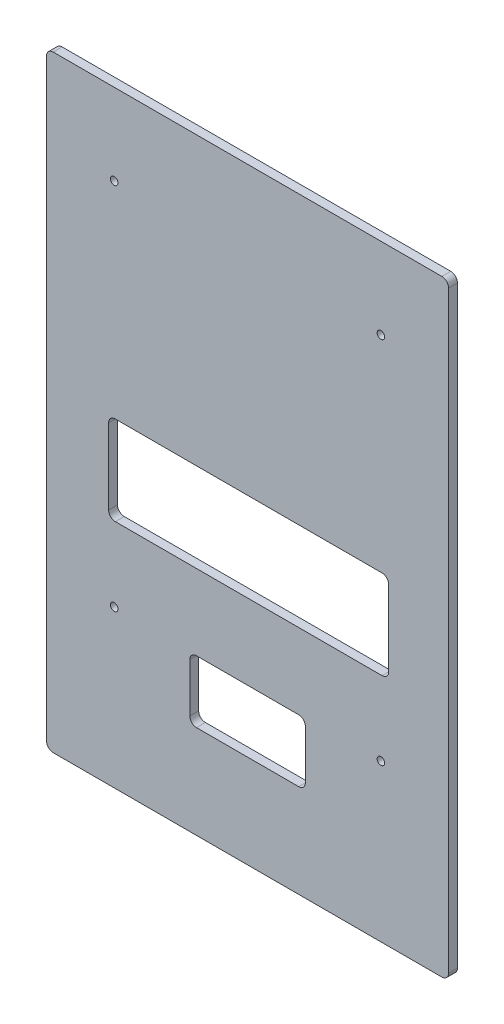
from build123d import *

# Parameters (mm, degrees)
ESQUISSE1_W        = 180.86
ESQUISSE1_H        = 273
ESQUISSE1_R        = 1.5
ESQUISSE1_W_2      = 52
ESQUISSE1_H_2      = 28
ESQUISSE1_W_3      = 126
ESQUISSE1_H_3      = 40
BOSS_EXTRU_1_DEPTH = 4
D_GAGEMENT_M31_D   = 3.4
CONG_1_R           = 3


with BuildPart() as part:
    # Esquisse1 → Boss.-Extru.1 (new body)
    with BuildSketch(Plane.XY):
        with Locations((90.43, 136.5)):
            Rectangle(ESQUISSE1_W, ESQUISSE1_H)
        with Locations((30.43, 236.5)):
            Circle(ESQUISSE1_R, mode=Mode.SUBTRACT)
        with Locations((150.43, 236.5)):
            Circle(ESQUISSE1_R, mode=Mode.SUBTRACT)
        with Locations((30.43, 70.5)):
            Circle(ESQUISSE1_R, mode=Mode.SUBTRACT)
        with Locations((150.43, 70.5)):
            Circle(ESQUISSE1_R, mode=Mode.SUBTRACT)
        with Locations((90.43, 56)):
            Rectangle(ESQUISSE1_W_2, ESQUISSE1_H_2, mode=Mode.SUBTRACT)
        with Locations((90.93, 124)):
            Rectangle(ESQUISSE1_W_3, ESQUISSE1_H_3, mode=Mode.SUBTRACT)
    extrude(amount=BOSS_EXTRU_1_DEPTH)

    # Dégagement M31 (through all)
    with Locations(Plane.XY.offset(4)):
        with Locations((30.43, 236.5), (150.43, 236.5), (150.43, 70.5), (30.43, 70.5)):
            Hole(D_GAGEMENT_M31_D / 2)

    # Congé1
    cong_1_edges = [part.edges().sort_by_distance(p)[0] for p in [
        (64.43, 70, 2),
        (64.43, 42, 2),
        (116.43, 42, 2),
        (116.43, 70, 2),
        (27.93, 144, 2),
        (27.93, 104, 2),
        (153.93, 104, 2),
        (153.93, 144, 2),
        (0, 273, 2),
        (180.86, 273, 2),
        (180.86, 0, 2),
        (0, 0, 2),
    ]]
    fillet(cong_1_edges, radius=CONG_1_R)


solid = part.part
